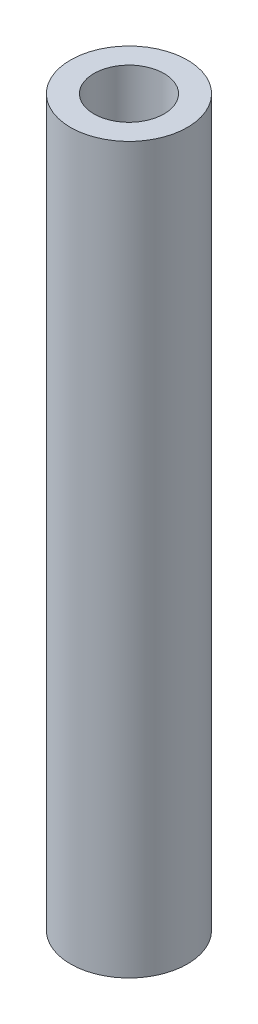
from build123d import *

# Parameters (mm, degrees)
SKETCH1_R           = 5
SKETCH1_R_2         = 3
BOSS_EXTRUDE1_DEPTH = 62


with BuildPart() as part:
    # Sketch1 → Boss-Extrude1 (new body)
    with BuildSketch(Plane(origin=(0, 0, 0), x_dir=(1, 0, 0), z_dir=(0, 1, 0))):
        with Locations(Location((0, 0, 0), (0, 0, 270))):
            Circle(SKETCH1_R)
        with Locations(Location((0, 0, 0), (0, 0, 270))):
            Circle(SKETCH1_R_2, mode=Mode.SUBTRACT)
    extrude(amount=BOSS_EXTRUDE1_DEPTH)


solid = part.part
